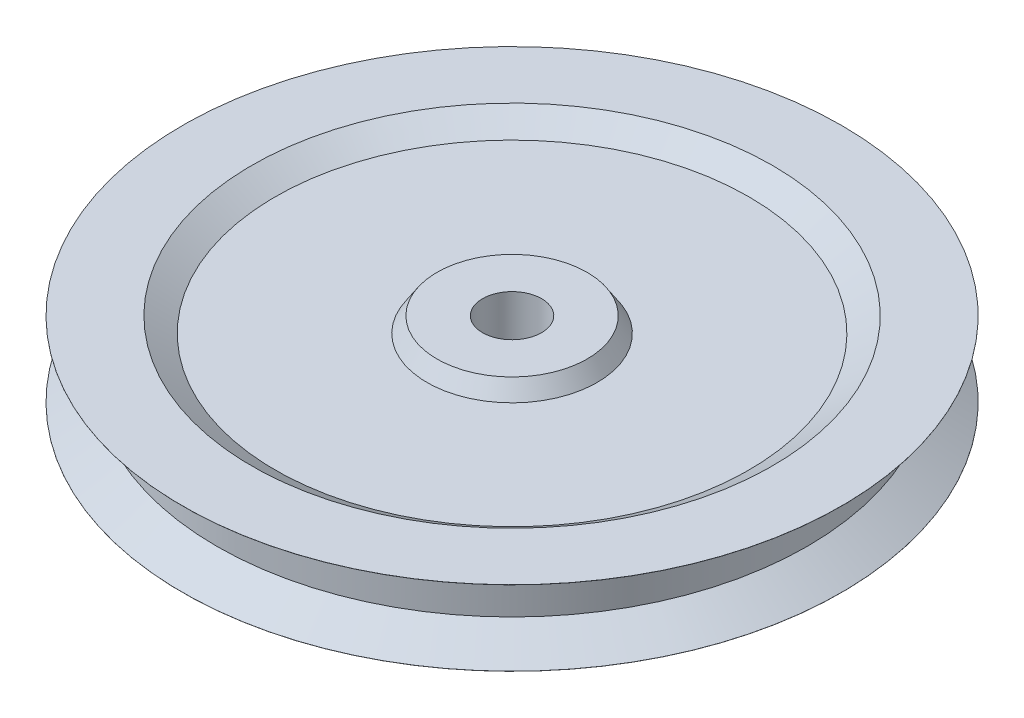
from build123d import *

# Parameters (mm, degrees)
CROQUIS2_R              = 25.443991431
CROQUIS2_R_2            = 10
SALIENTE_EXTRUIR1_DEPTH = 20


with BuildPart() as part:
    # Croquis1 → Revolución1 (revolve)
    with BuildSketch(Plane.XY, mode=Mode.PRIVATE) as revoluci_n1_sk:
        Polygon((100, 5), (100, -5), (111.6503736, -12.670841247), (111.6503736, -12.7), (88.202160832, -12.7), (80.211990776, -7.5), (28.828149692, -7.5), (25.443991431, -12.7), (10, -12.7), (10, 12.7), (25.443991431, 12.7), (28.828149692, 7.5), (80.211990776, 7.5), (88.202160832, 12.7), (111.6503736, 12.7), (111.6503736, 12.670841247), align=None)
    revolve(revoluci_n1_sk.sketch.rotate(Axis((0, -23.836508292, 0), (0, 1, 0)), 90), axis=Axis((0, -23.836508292, 0), (0, 1, 0)))

    # Croquis2 → Saliente-Extruir1 (add)
    with BuildSketch(Plane.XZ.offset(12.7)):
        with Locations(Location((0, 0, 0), (0, 0, 270))):
            Circle(CROQUIS2_R)
        with Locations(Location((0, 0, 0), (0, 0, 270))):
            Circle(CROQUIS2_R_2, mode=Mode.SUBTRACT)
    extrude(amount=SALIENTE_EXTRUIR1_DEPTH)


solid = part.part
